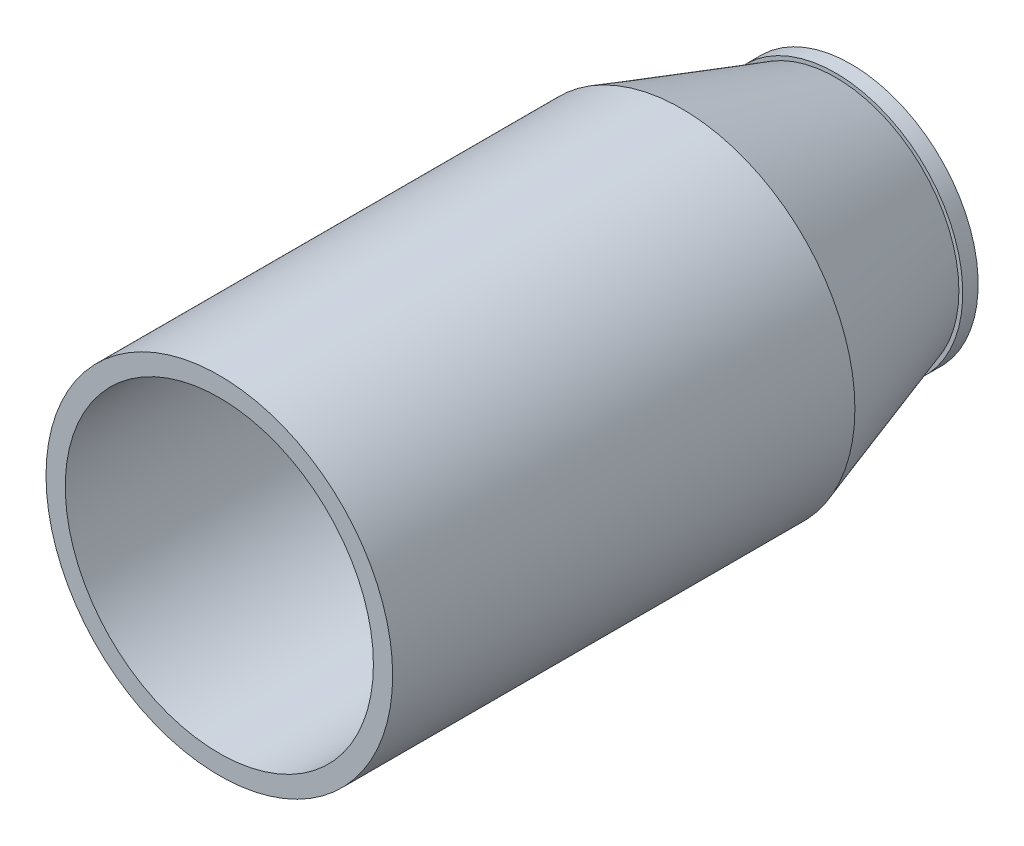
from build123d import *

# Parameters (mm, degrees)
SKETCH1_R           = 1125
SKETCH1_R_2         = 1000
BOSS_EXTRUDE1_DEPTH = 2000
CUT_EXTRUDE1_START  = -1200
SKETCH3_R           = 1000
CUT_EXTRUDE1_DEPTH  = 1200
SKETCH4_R           = 750
CUT_EXTRUDE2_DEPTH  = 1000
SKETCH5_R           = 825
SKETCH5_R_2         = 800
BOSS_EXTRUDE2_DEPTH = 100


with BuildPart() as part:
    # Sketch1 → Boss-Extrude1 (new body)
    with BuildSketch(Plane.XY):
        Circle(SKETCH1_R)
        Circle(SKETCH1_R_2, mode=Mode.SUBTRACT)
    extrude(amount=BOSS_EXTRUDE1_DEPTH)

    # Sketch2 → Revolve1 (revolve)
    with BuildSketch(Plane(origin=(0, 0, 0), x_dir=(0, 0, -1), z_dir=(1, 0, 0)), mode=Mode.PRIVATE) as revolve1_sk:
        Polygon((0, 0), (2000, 0), (2000, -800), (1000, -1125), (0, -1125), align=None)
    revolve(revolve1_sk.sketch.rotate(Axis((0, 0, 0), (0, 0, -1)), 270), axis=Axis((0, 0, 0), (0, 0, -1)))

    # Sketch3 → Cut-Extrude1 (cut)
    with BuildSketch(Plane.XY.offset(CUT_EXTRUDE1_START)):
        Circle(SKETCH3_R)
    extrude(amount=CUT_EXTRUDE1_DEPTH, mode=Mode.SUBTRACT)

    # Sketch4 → Cut-Extrude2 (cut)
    with BuildSketch(Plane(origin=(0, 0, -2000), x_dir=(-1, 0, 0), z_dir=(0, 0, -1))):
        Circle(SKETCH4_R)
    extrude(amount=-CUT_EXTRUDE2_DEPTH, mode=Mode.SUBTRACT)


with BuildPart() as body_2:
    # Sketch5 → Boss-Extrude2 (new body)
    with BuildSketch(Plane(origin=(0, 0, -2000), x_dir=(-1, 0, 0), z_dir=(0, 0, -1))):
        Circle(SKETCH5_R)
        Circle(SKETCH5_R_2, mode=Mode.SUBTRACT)
    extrude(amount=BOSS_EXTRUDE2_DEPTH)


solid = Compound([part.part, body_2.part])
